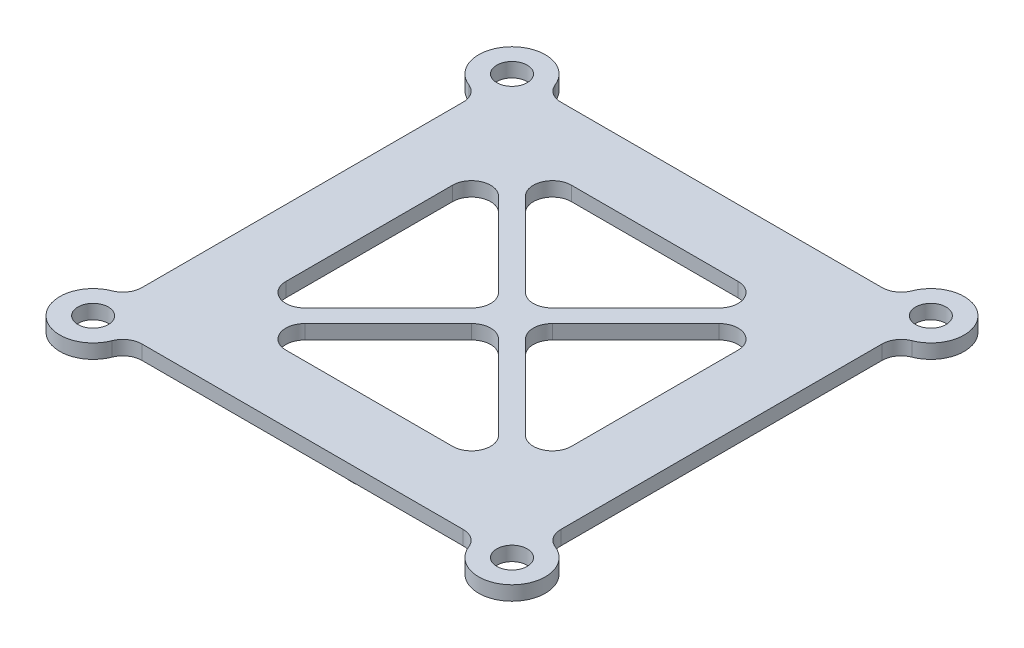
from build123d import *

# Parameters (mm, degrees)
BOSS_EXTRUDE1_DEPTH            = 0.75
FILLET1_R                      = 2
F_3_2_3_2_DIAMETER_HOLE1_D     = 3.2
F_3_2_3_2_DIAMETER_HOLE1_DEPTH = 10
F_3_2_3_2_DIAMETER_HOLE1_TIP   = 0.96137699
CUT_EXTRUDE1_DEPTH             = 1.5
FILLET2_R                      = 2
SKETCH5_W                      = 0.759829059
SKETCH5_H                      = 4.233333333
BOSS_EXTRUDE2_DEPTH            = 0.7
BOSS_EXTRUDE3_DEPTH            = 0.7


with BuildPart() as part:
    # Sketch1 → Boss-Extrude1 (new, symmetric)
    with BuildSketch(Plane(origin=(0, 0, 0), x_dir=(1, 0, 0), z_dir=(0, 1, 0))):
        with BuildLine():
            Line((-18.5, -22), (18.5, -22))
            ThreePointArc((18.5, -22), (24.474873734, -24.474873734), (22, -18.5))
            Line((22, -18.5), (22, 18.5))
            ThreePointArc((22, 18.5), (24.474873734, 24.474873734), (18.5, 22))
            Line((18.5, 22), (-18.5, 22))
            ThreePointArc((-18.5, 22), (-24.474873734, 24.474873734), (-22, 18.5))
            Line((-22, 18.5), (-22, -18.5))
            ThreePointArc((-22, -18.5), (-24.474873734, -24.474873734), (-18.5, -22))
        make_face()
    extrude(amount=BOSS_EXTRUDE1_DEPTH, both=True)

    # Fillet1
    fillet1_edges = [part.edges().sort_by_distance(p)[0] for p in [
        (-18.5, 0, -22),
        (18.5, 0, -22),
        (22, 0, -18.5),
        (22, 0, 18.5),
        (18.5, 0, 22),
        (-18.5, 0, 22),
        (-22, 0, 18.5),
        (-22, 0, -18.5),
    ]]
    fillet(fillet1_edges, radius=FILLET1_R)

    # Ø3.2 (3.2) Diameter Hole1
    with Locations(Plane(origin=(0, 0.75, 0), x_dir=(1, 0, 0), z_dir=(0, 1, 0))):
        with Locations((-22, 22), (-22, -22), (22, -22), (22, 22)):
            Hole(F_3_2_3_2_DIAMETER_HOLE1_D / 2, depth=F_3_2_3_2_DIAMETER_HOLE1_DEPTH)
            with Locations((0, 0, -(F_3_2_3_2_DIAMETER_HOLE1_DEPTH + F_3_2_3_2_DIAMETER_HOLE1_TIP / 2))):  # 118° drill point
                Cone(0, F_3_2_3_2_DIAMETER_HOLE1_D / 2, F_3_2_3_2_DIAMETER_HOLE1_TIP, mode=Mode.SUBTRACT)

    # Sketch4 → Cut-Extrude1 (cut)
    with BuildSketch(Plane(origin=(0, 0.75, 0), x_dir=(1, 0, 0), z_dir=(0, 1, 0))):
        Polygon((-1.414213562, 0), (-15, 13.585786438), (-15, -13.585786438), align=None)
        Polygon((13.585786438, 15), (-13.585786438, 15), (0, 1.414213562), align=None)
        Polygon((15, -13.585786438), (15, 13.585786438), (1.414213562, 0), align=None)
        Polygon((0, -1.414213562), (-13.585786438, -15), (13.585786438, -15), align=None)
    extrude(amount=-CUT_EXTRUDE1_DEPTH, mode=Mode.SUBTRACT)

    # Fillet2
    fillet2_edges = [part.edges().sort_by_distance(p)[0] for p in [
        (-1.414213562, 0, 0),
        (-15, 0, 13.585786438),
        (-15, 0, -13.585786438),
        (13.585786438, 0, -15),
        (0, 0, -1.414213562),
        (-13.585786438, 0, -15),
        (15, 0, -13.585786438),
        (15, 0, 13.585786438),
        (1.414213562, 0, 0),
        (0, 0, 1.414213562),
        (13.585786438, 0, 15),
        (-13.585786438, 0, 15),
    ]]
    fillet(fillet2_edges, radius=FILLET2_R)

    # Sketch5 → Boss-Extrude2 (add)
    # profile 1 of 8: a face of its own
    with BuildSketch(Plane.XZ.offset(0.75)):
        Polygon((-12.790030195, -16.641256876), (-12.083626616, -16.641256876), (-10.374011231, -20.874590209), (-11.185569725, -20.874590209), (-11.514602844, -20.006214141), (-13.357357919, -20.006214141), (-13.687239062, -20.874590209), (-14.498797556, -20.874590209), align=None)
        Polygon((-12.436404394, -17.776760348), (-13.069029928, -19.246385081), (-11.802930836, -19.246385081), align=None, mode=Mode.SUBTRACT)
    # profile 2 of 8: a face of its own
    with BuildSketch(Plane.XZ.offset(0.75)):
        Polygon((-9.749865932, -16.641256876), (-8.990036872, -16.641256876), (-8.990036872, -18.131234173), (-7.78923559, -16.641256876), (-6.830121007, -16.641256876), (-8.338754821, -18.513692774), (-6.683412941, -20.874590209), (-7.598430302, -20.874590209), (-8.990036872, -18.889367186), (-8.990036872, -20.874590209), (-9.749865932, -20.874590209), align=None)
    # profile 3 of 8: a face of its own
    with BuildSketch(Plane.XZ.offset(0.75)):
        Polygon((-4.811825067, -16.641256876), (-4.105421488, -16.641256876), (-2.395806103, -20.874590209), (-3.207364597, -20.874590209), (-3.536397716, -20.006214141), (-5.379152791, -20.006214141), (-5.709033934, -20.874590209), (-6.520592428, -20.874590209), align=None)
        Polygon((-4.458199265, -17.776760348), (-5.0908248, -19.246385081), (-3.824725708, -19.246385081), align=None, mode=Mode.SUBTRACT)
    # profile 4 of 8: a face of its own
    with BuildSketch(Plane.XZ.offset(0.75)):
        with BuildLine():
            Line((0.399279367, -17.206888553), (-0.168896381, -17.726726962))
            add(Edge.make_bspline(
                [(-0.168896381, -17.726726962), (-0.193234594, -17.692395382), (-0.239960568, -17.626483538), (-0.315698499, -17.538226024), (-0.391094434, -17.462935797), (-0.466846871, -17.400927385), (-0.543627251, -17.352577533), (-0.621302294, -17.318345304), (-0.699431639, -17.296583552), (-0.751922498, -17.29387369), (-0.777777257, -17.292538927)],
                knots=[0, 0, 0, 0, 1.299362458, 2.494594718, 3.587462134, 4.587049575, 5.512617175, 6.380583204, 7.202344345, 8, 8, 8, 8], degree=3))
            add(Edge.make_bspline(
                [(-0.777777257, -17.292538927), (-0.801893834, -17.293384694), (-0.848456609, -17.295017647), (-0.914835299, -17.311249081), (-0.973767245, -17.339262151), (-1.025194933, -17.375891597), (-1.065933249, -17.420021587), (-1.098459635, -17.4663026), (-1.116774724, -17.517386371), (-1.11918535, -17.552472766), (-1.120378753, -17.569842613)],
                knots=[0, 0, 0, 0, 1.185010067, 2.2879431, 3.333075148, 4.379039566, 5.372662701, 6.27520591, 7.14612461, 8, 8, 8, 8], degree=3))
            add(Edge.make_bspline(
                [(-1.120378753, -17.569842613), (-1.119630907, -17.587462941), (-1.118124851, -17.622947833), (-1.1035784, -17.67495536), (-1.081652744, -17.725772769), (-1.060701884, -17.756707744), (-1.049992802, -17.772520231)],
                knots=[0, 0, 0, 0, 0.967525499, 1.948461899, 2.951351359, 4, 4, 4, 4], degree=3))
            add(Edge.make_bspline(
                [(-1.049992802, -17.772520231), (-1.040257087, -17.784811111), (-1.017846759, -17.813103095), (-0.975114852, -17.857913188), (-0.921452552, -17.912809473), (-0.85479482, -17.975904229), (-0.777908801, -18.04946659), (-0.68723073, -18.130604792), (-0.585370717, -18.221831589), (-0.51297098, -18.285358628), (-0.475032866, -18.318647368)],
                knots=[0, 0, 0, 0, 0.473873513, 1.090794244, 1.870441696, 2.795289791, 3.865433203, 5.087734844, 6.473946851, 8, 8, 8, 8], degree=3))
            add(Edge.make_bspline(
                [(-0.475032866, -18.318647368), (-0.439422489, -18.349466353), (-0.371841391, -18.407954384), (-0.275686909, -18.490968754), (-0.191183134, -18.565654758), (-0.117099039, -18.630891519), (-0.054557665, -18.687363521), (-0.00329609, -18.735340699), (0.037311761, -18.773889026), (0.060394946, -18.797172238), (0.070246247, -18.807108906)],
                knots=[0, 0, 0, 0, 1.543621617, 2.929473131, 4.163658386, 5.240097082, 6.164993805, 6.925417477, 7.541396219, 8, 8, 8, 8], degree=3))
            add(Edge.make_bspline(
                [(0.070246247, -18.807108906), (0.107620031, -18.847555344), (0.179465567, -18.925307601), (0.272839437, -19.045799147), (0.349689152, -19.163423465), (0.409141549, -19.280393847), (0.454042391, -19.398397942), (0.485698079, -19.520329796), (0.504656881, -19.647463518), (0.50676175, -19.734216764), (0.507826376, -19.778095818)],
                knots=[0, 0, 0, 0, 1.206664779, 2.319633467, 3.337109185, 4.282041471, 5.190008762, 6.099243693, 7.03861361, 8, 8, 8, 8], degree=3))
            add(Edge.make_bspline(
                [(0.507826376, -19.778095818), (0.507068603, -19.820850576), (0.505581824, -19.904737001), (0.487371635, -20.027492289), (0.461404975, -20.144974427), (0.421255964, -20.255905044), (0.372322586, -20.362105031), (0.31097753, -20.461920131), (0.238936173, -20.556360514), (0.156365716, -20.643737941), (0.065032987, -20.7230269), (-0.032930046, -20.793611804), (-0.138481314, -20.851888633), (-0.250719002, -20.899875445), (-0.369583035, -20.936835529), (-0.494931807, -20.964152476), (-0.626957049, -20.980547677), (-0.717237812, -20.982261601), (-0.763360857, -20.983137218)],
                knots=[0, 0, 0, 0, 1.043214005, 2.046824704, 3.02475056, 3.976699089, 4.921714032, 5.875962561, 6.831408892, 7.817874052, 8.806269674, 9.781291748, 10.760897367, 11.74438705, 12.757449933, 13.795994037, 14.874007457, 16, 16, 16, 16], degree=3))
            add(Edge.make_bspline(
                [(-0.763360857, -20.983137218), (-0.799567055, -20.982494896), (-0.87127609, -20.98122273), (-0.976964367, -20.970836553), (-1.079018346, -20.954074368), (-1.177323072, -20.930049151), (-1.272321425, -20.899605941), (-1.364017307, -20.862420727), (-1.451777711, -20.817917151), (-1.536266673, -20.767010385), (-1.617073473, -20.707900923), (-1.69521988, -20.641797239), (-1.769929672, -20.56768263), (-1.841561664, -20.485732374), (-1.909657533, -20.395714406), (-1.976446303, -20.298882394), (-2.03895968, -20.193439268), (-2.077576973, -20.119470062), (-2.09730183, -20.081688233)],
                knots=[0, 0, 0, 0, 1.016823716, 2.013894106, 2.979844003, 3.91962641, 4.853723003, 5.779685073, 6.695824784, 7.614987388, 8.547259901, 9.504950863, 10.487499108, 11.500346958, 12.559593716, 13.656357062, 14.802919212, 16, 16, 16, 16], degree=3))
            Line((-2.09730183, -20.081688233), (-1.429059308, -19.680573115))
            add(Edge.make_bspline(
                [(-1.429059308, -19.680573115), (-1.404386461, -19.723460427), (-1.357086504, -19.80567907), (-1.276932306, -19.916150236), (-1.194818421, -20.010750504), (-1.108846452, -20.087807807), (-1.020061784, -20.148352501), (-0.928035567, -20.19162194), (-0.832703145, -20.218405674), (-0.76776703, -20.221676586), (-0.735376082, -20.223308158)],
                knots=[0, 0, 0, 0, 1.283663364, 2.460892379, 3.537111102, 4.529833553, 5.449777664, 6.316464042, 7.160231139, 8, 8, 8, 8], degree=3))
            add(Edge.make_bspline(
                [(-0.735376082, -20.223308158), (-0.702429849, -20.221975728), (-0.63850936, -20.219390619), (-0.547271042, -20.195512748), (-0.463620297, -20.158022738), (-0.391313211, -20.104529664), (-0.330088129, -20.042790526), (-0.284900505, -19.974102913), (-0.256513334, -19.899784573), (-0.253512122, -19.848158165), (-0.252002684, -19.822193041)],
                knots=[0, 0, 0, 0, 1.13588714, 2.203786484, 3.234766741, 4.283437687, 5.291419208, 6.222934724, 7.106237994, 8, 8, 8, 8], degree=3))
            add(Edge.make_bspline(
                [(-0.252002684, -19.822193041), (-0.253396588, -19.798036717), (-0.256228171, -19.748965459), (-0.277084735, -19.676004389), (-0.309689906, -19.603076501), (-0.348264122, -19.543259073), (-0.387518217, -19.493175563), (-0.425053986, -19.449780466), (-0.470762624, -19.401836482), (-0.524528232, -19.3492833), (-0.585640428, -19.291658281), (-0.65415069, -19.228967068), (-0.730843534, -19.161761895), (-0.785050187, -19.115982396), (-0.813394244, -19.092044803)],
                knots=[0, 0, 0, 0, 0.916159276, 1.861089862, 2.860218735, 3.940849679, 4.552606315, 5.27541173, 6.11797699, 7.06649574, 8.129236253, 9.306560635, 10.591630461, 12, 12, 12, 12], degree=3))
            add(Edge.make_bspline(
                [(-0.813394244, -19.092044803), (-0.867277425, -19.046454466), (-0.970695558, -18.958952808), (-1.1168385, -18.829715615), (-1.248526377, -18.708931615), (-1.36462179, -18.595107656), (-1.466603975, -18.490345802), (-1.553782263, -18.393795136), (-1.625198962, -18.304710903), (-1.700349638, -18.19919659), (-1.771757805, -18.070620151), (-1.833474726, -17.915927788), (-1.873514059, -17.761255053), (-1.87799991, -17.657416299), (-1.880207812, -17.606307624)],
                knots=[0, 0, 0, 0, 1.345494975, 2.582412109, 3.71882943, 4.751509156, 5.681369928, 6.505683931, 7.230279997, 7.856715994, 8.973648664, 10.023341002, 11.027102913, 12, 12, 12, 12], degree=3))
            add(Edge.make_bspline(
                [(-1.880207812, -17.606307624), (-1.879289549, -17.570064095), (-1.87748047, -17.49866045), (-1.861343212, -17.393671793), (-1.837225466, -17.292366561), (-1.802199574, -17.195114361), (-1.756740195, -17.102037005), (-1.701531545, -17.012678841), (-1.635716339, -16.927862301), (-1.561547045, -16.847643612), (-1.479831472, -16.77433286), (-1.392507998, -16.709628775), (-1.300070881, -16.654978764), (-1.203085605, -16.609642611), (-1.100951192, -16.574940667), (-0.994420062, -16.550342199), (-0.883339416, -16.535711814), (-0.807784758, -16.533722983), (-0.769297022, -16.532709868)],
                knots=[0, 0, 0, 0, 1.010766082, 1.991317756, 2.957454644, 3.913069143, 4.869106762, 5.843196583, 6.838735724, 7.860187025, 8.887984031, 9.89767229, 10.887916223, 11.879572884, 12.879850636, 13.892031539, 14.926195476, 16, 16, 16, 16], degree=3))
            add(Edge.make_bspline(
                [(-0.769297022, -16.532709868), (-0.719418821, -16.534534518), (-0.62005614, -16.538169417), (-0.473145551, -16.566593136), (-0.32964943, -16.611292428), (-0.214017566, -16.665217206), (-0.12201145, -16.717454164), (-0.051497357, -16.765547375), (0.020254528, -16.820640733), (0.09382284, -16.882907851), (0.167840565, -16.953521925), (0.244412382, -17.03080193), (0.322494905, -17.115415746), (0.373236165, -17.175863464), (0.399279367, -17.206888553)],
                knots=[0, 0, 0, 0, 1.282922637, 2.555718331, 3.837320111, 5.142675274, 5.830281639, 6.55870424, 7.337177975, 8.157850921, 9.037902056, 9.96903443, 10.957596896, 12, 12, 12, 12], degree=3))
        make_face()
    # profile 5 of 8: a face of its own
    with BuildSketch(Plane.XZ.offset(0.75)):
        Polygon((1.267655435, -16.641256876), (2.027484495, -16.641256876), (2.027484495, -18.269462004), (3.492869111, -18.269462004), (3.492869111, -16.641256876), (4.25269817, -16.641256876), (4.25269817, -20.874590209), (3.492869111, -20.874590209), (3.492869111, -19.029291064), (2.027484495, -19.029291064), (2.027484495, -20.874590209), (1.267655435, -20.874590209), align=None)
    # profile 6 of 8: a face of its own
    with BuildSketch(Plane.XZ.offset(0.75)):
        with BuildLine():
            Line((5.229621247, -16.641256876), (6.187039784, -16.641256876))
            add(Edge.make_bspline(
                [(6.187039784, -16.641256876), (6.261681571, -16.641778648), (6.405964989, -16.642787238), (6.615003119, -16.654151627), (6.809381978, -16.671629251), (6.989226869, -16.69567289), (7.154169079, -16.727489208), (7.303995919, -16.767396544), (7.439210245, -16.813462923), (7.561294652, -16.867669367), (7.672745973, -16.930868697), (7.778572559, -17.001267676), (7.878566623, -17.081445226), (7.974131423, -17.169854561), (8.064033674, -17.268113103), (8.149770572, -17.374593334), (8.229242887, -17.490839366), (8.304852897, -17.614063983), (8.37323209, -17.744789402), (8.432874977, -17.881902914), (8.482838186, -18.024522142), (8.52343588, -18.172799082), (8.555796927, -18.326241499), (8.5784393, -18.485159026), (8.59243704, -18.649404532), (8.593856994, -18.760721776), (8.594578512, -18.817285188)],
                knots=[0, 0, 0, 0, 1.44355588, 2.790409838, 4.047694926, 5.217575253, 6.298404546, 7.294384826, 8.214239204, 9.058592145, 9.873746385, 10.689560431, 11.514393297, 12.350027578, 13.205127629, 14.088021785, 14.991911688, 15.926770944, 16.882954281, 17.842803888, 18.816321264, 19.80318086, 20.814351908, 21.847355356, 22.906180909, 24, 24, 24, 24], degree=3))
            add(Edge.make_bspline(
                [(8.594578512, -18.817285188), (8.592689188, -18.897099845), (8.588969942, -19.054219668), (8.557641094, -19.284791198), (8.506971739, -19.505817007), (8.435726023, -19.715568144), (8.347400408, -19.912176746), (8.24188557, -20.092175701), (8.120728602, -20.254598867), (7.98534099, -20.398637509), (7.838749181, -20.522440674), (7.68641073, -20.628469024), (7.526841584, -20.712081226), (7.386238866, -20.765103866), (7.264318768, -20.79807936), (7.157274242, -20.817568195), (7.035682582, -20.835440632), (6.898410051, -20.849252067), (6.746058836, -20.861568472), (6.578021661, -20.868260728), (6.394842583, -20.873820999), (6.267607394, -20.874327087), (6.201456183, -20.874590209)],
                knots=[0, 0, 0, 0, 1.315458931, 2.589557908, 3.828601765, 5.048913369, 6.235739168, 7.376350998, 8.481830359, 9.569842114, 10.627874879, 11.640079404, 12.624025415, 13.590060155, 14.111227486, 14.704434459, 15.382649715, 16.137166398, 16.978595427, 17.902333227, 18.909396075, 20, 20, 20, 20], degree=3))
            Line((6.201456183, -20.874590209), (5.229621247, -20.874590209))
            Line((5.229621247, -20.874590209), (5.229621247, -16.641256876))
        make_face()
        with BuildLine():
            Line((5.989450307, -17.401085936), (5.989450307, -20.11476115))
            Line((5.989450307, -20.11476115), (6.386325307, -20.11476115))
            add(Edge.make_bspline(
                [(6.386325307, -20.11476115), (6.433547337, -20.114674619), (6.524371021, -20.114508193), (6.655499862, -20.106581151), (6.77676079, -20.098624586), (6.887820005, -20.083522761), (6.989485758, -20.06670039), (7.080361431, -20.043289758), (7.162320364, -20.018698872), (7.234361446, -19.987391627), (7.300345206, -19.952153238), (7.361438632, -19.910867381), (7.420410893, -19.865020993), (7.476159455, -19.813265668), (7.528895312, -19.756286742), (7.578306447, -19.69379063), (7.625052366, -19.625968008), (7.667933192, -19.552460282), (7.707117919, -19.474043709), (7.741879164, -19.391477869), (7.770701365, -19.304075165), (7.794656614, -19.212653793), (7.811775356, -19.116417825), (7.825937849, -19.016080068), (7.833239027, -18.911242992), (7.834241068, -18.839908342), (7.834749453, -18.803716812)],
                knots=[0, 0, 0, 0, 1.50275155, 2.890291501, 4.180787663, 5.369391935, 6.45668281, 7.458360028, 8.354766181, 9.177074746, 9.954075863, 10.732690366, 11.5210699, 12.329727389, 13.151100085, 13.990027547, 14.863562427, 15.770965086, 16.696477834, 17.652329173, 18.619756807, 19.62365428, 20.657822005, 21.729286259, 22.847956731, 24, 24, 24, 24], degree=3))
            add(Edge.make_bspline(
                [(7.834749453, -18.803716812), (7.833736924, -18.748256714), (7.831762572, -18.640113821), (7.812722346, -18.482601336), (7.78172849, -18.334279735), (7.737503244, -18.195699479), (7.681755951, -18.066471085), (7.611975218, -17.947689392), (7.531164141, -17.837359029), (7.467260945, -17.772635698), (7.435330382, -17.740295338)],
                knots=[0, 0, 0, 0, 1.13821349, 2.219428113, 3.251817212, 4.244760574, 5.201143372, 6.134805572, 7.068016741, 8, 8, 8, 8], degree=3))
            add(Edge.make_bspline(
                [(7.435330382, -17.740295338), (7.403843823, -17.712736978), (7.339536093, -17.65645215), (7.22663285, -17.589008531), (7.102219324, -17.529752702), (6.963449306, -17.482769437), (6.811663947, -17.445613069), (6.64595921, -17.41998723), (6.46722248, -17.403520338), (6.343397838, -17.401914788), (6.279474346, -17.401085936)],
                knots=[0, 0, 0, 0, 0.813307809, 1.661089106, 2.549956539, 3.493439533, 4.508053171, 5.589449661, 6.755572447, 8, 8, 8, 8], degree=3))
            Line((6.279474346, -17.401085936), (5.989450307, -17.401085936))
        make_face(mode=Mode.SUBTRACT)
    # profile 7 of 8: a face of its own
    with BuildSketch(Plane.XZ.offset(0.75)):
        with Locations((9.625775093, -18.757923543)):
            Rectangle(SKETCH5_W, SKETCH5_H)
    # profile 8 of 8: a face of its own
    with BuildSketch(Plane.XZ.offset(0.75)):
        with BuildLine():
            Line((10.9826127, -16.641256876), (11.830636205, -16.641256876))
            add(Edge.make_bspline(
                [(11.830636205, -16.641256876), (11.88604496, -16.641504898), (11.992940064, -16.641983383), (12.147091599, -16.647785653), (12.289303937, -16.658183674), (12.419544406, -16.671033984), (12.537759455, -16.689049618), (12.644097122, -16.709703133), (12.738579478, -16.734865124), (12.822271949, -16.764732059), (12.897383239, -16.799944009), (12.968462745, -16.837447249), (13.033904062, -16.882206043), (13.097010211, -16.929396478), (13.154173305, -16.98352664), (13.20895952, -17.040994086), (13.259048511, -17.104077928), (13.30467237, -17.172014554), (13.346060241, -17.243548786), (13.382219453, -17.318808504), (13.411549782, -17.397912801), (13.43615428, -17.48034996), (13.455916853, -17.56611639), (13.46907145, -17.655739561), (13.478006715, -17.74859369), (13.478795128, -17.811790269), (13.479193897, -17.843754205)],
                knots=[0, 0, 0, 0, 1.698747864, 3.27724071, 4.728299578, 6.070144658, 7.288476769, 8.393259625, 9.389771311, 10.283485332, 11.113357557, 11.931608583, 12.74405601, 13.541433047, 14.344816069, 15.154114104, 15.974336324, 16.810834471, 17.661136416, 18.50621059, 19.367396281, 20.244825668, 21.142564693, 22.063065223, 23.020325768, 24, 24, 24, 24], degree=3))
            add(Edge.make_bspline(
                [(13.479193897, -17.843754205), (13.478616929, -17.879115147), (13.477483116, -17.948603743), (13.466368092, -18.050465499), (13.44738012, -18.147581461), (13.422563834, -18.240770626), (13.387959289, -18.328499824), (13.34842522, -18.412862302), (13.299785775, -18.491492794), (13.244207434, -18.565374873), (13.183509546, -18.635109237), (13.116251143, -18.698682435), (13.043714202, -18.756527846), (12.966318612, -18.809251693), (12.883773806, -18.85674762), (12.796139346, -18.899460377), (12.702816813, -18.936023878), (12.637829809, -18.955146292), (12.604881664, -18.964841278)],
                knots=[0, 0, 0, 0, 1.102006807, 2.165578795, 3.188629044, 4.184801286, 5.166646146, 6.124351954, 7.085497154, 8.042432466, 9.003981491, 9.963833307, 10.922997304, 11.89326795, 12.880200226, 13.889073926, 14.929769137, 16, 16, 16, 16], degree=3))
            add(Edge.make_bspline(
                [(12.604881664, -18.964841278), (12.583180121, -18.970240657), (12.536167589, -18.981937451), (12.458374763, -18.993812632), (12.368726698, -19.004731132), (12.266933504, -19.01411426), (12.152936495, -19.020492601), (12.02684605, -19.025473802), (11.888605026, -19.029095649), (11.792477684, -19.029224168), (11.74244176, -19.029291064)],
                knots=[0, 0, 0, 0, 0.618981996, 1.340914327, 2.176866532, 3.120127938, 4.170906482, 5.338178032, 6.614476169, 8, 8, 8, 8], degree=3))
            Line((11.74244176, -19.029291064), (11.74244176, -20.874590209))
            Line((11.74244176, -20.874590209), (10.9826127, -20.874590209))
            Line((10.9826127, -20.874590209), (10.9826127, -16.641256876))
        make_face()
        with BuildLine():
            Line((11.74244176, -18.269462004), (12.011265211, -18.269462004))
            add(Edge.make_bspline(
                [(12.011265211, -18.269462004), (12.060181882, -18.269151835), (12.150189283, -18.268581118), (12.273107609, -18.260328221), (12.37188714, -18.247724382), (12.449924804, -18.22964756), (12.511542931, -18.20221359), (12.564684708, -18.170477653), (12.610265766, -18.130348432), (12.649732254, -18.084493931), (12.681284522, -18.03180481), (12.703164376, -17.973139011), (12.717377099, -17.909729164), (12.718689776, -17.865600107), (12.719364837, -17.842906182)],
                knots=[0, 0, 0, 0, 1.8619151, 3.425951444, 4.686033666, 5.651700536, 6.461346321, 7.243864085, 7.999046032, 8.762387399, 9.539336099, 10.322741239, 11.137448474, 12, 12, 12, 12], degree=3))
            add(Edge.make_bspline(
                [(12.719364837, -17.842906182), (12.71869672, -17.823078795), (12.717400413, -17.784608897), (12.707877387, -17.729087292), (12.692700423, -17.677329702), (12.670709585, -17.629876668), (12.642280639, -17.586808819), (12.607620001, -17.548143121), (12.567172434, -17.513051516), (12.535944548, -17.494476994), (12.520079314, -17.485040263)],
                knots=[0, 0, 0, 0, 1.102301479, 2.1387299, 3.123554645, 4.094223062, 5.036071848, 5.982632524, 6.975082478, 8, 8, 8, 8], degree=3))
            add(Edge.make_bspline(
                [(12.520079314, -17.485040263), (12.506640544, -17.478243892), (12.478187916, -17.463854582), (12.429730331, -17.447125957), (12.373811018, -17.433013519), (12.310052459, -17.421300331), (12.238709004, -17.412209682), (12.159793384, -17.405257609), (12.073189464, -17.402461909), (12.012961621, -17.401557244), (11.981584388, -17.401085936)],
                knots=[0, 0, 0, 0, 0.656809284, 1.390599849, 2.23162475, 3.173112763, 4.218524733, 5.370385145, 6.63003504, 8, 8, 8, 8], degree=3))
            Line((11.981584388, -17.401085936), (11.74244176, -17.401085936))
            Line((11.74244176, -17.401085936), (11.74244176, -18.269462004))
        make_face(mode=Mode.SUBTRACT)
    extrude(amount=BOSS_EXTRUDE2_DEPTH)

    # Sketch6 → Boss-Extrude3 (add)
    # profile 1 of 7: a face of its own
    with BuildSketch(Plane.XZ.offset(0.75)):
        with BuildLine():
            Line((-10.234058943, 15.95628585), (-12.161616368, 15.95628585))
            Line((-12.161616368, 15.95628585), (-12.161616368, 16.661841406))
            Line((-12.161616368, 16.661841406), (-10.836155631, 16.661841406))
            Line((-10.836155631, 16.661841406), (-10.670791048, 17.462375594))
            add(Edge.make_bspline(
                [(-10.670791048, 17.462375594), (-10.693321103, 17.456081142), (-10.738022676, 17.443592407), (-10.805024086, 17.431484066), (-10.869871259, 17.4232056), (-10.912170972, 17.422174204), (-10.932830311, 17.421670465)],
                knots=[0, 0, 0, 0, 1.054652254, 2.092520994, 3.068380062, 4, 4, 4, 4], degree=3))
            add(Edge.make_bspline(
                [(-10.932830311, 17.421670465), (-10.977844357, 17.422701936), (-11.06657696, 17.424735192), (-11.196381497, 17.444037425), (-11.32067701, 17.474437857), (-11.43908314, 17.517795146), (-11.55148422, 17.574225776), (-11.658016503, 17.642491021), (-11.758810739, 17.722710778), (-11.852076398, 17.814935271), (-11.937772781, 17.916199853), (-12.012280899, 18.025728213), (-12.075915481, 18.141958584), (-12.126528228, 18.265613451), (-12.166476123, 18.395916178), (-12.195343363, 18.532950267), (-12.212414005, 18.676878124), (-12.214715876, 18.775069811), (-12.215889873, 18.825149365)],
                knots=[0, 0, 0, 0, 1.01440847, 1.999622559, 2.951875003, 3.895578053, 4.836219714, 5.782137149, 6.743708247, 7.735272588, 8.734977101, 9.730283169, 10.717124674, 11.717316708, 12.737475749, 13.78628267, 14.87096371, 16, 16, 16, 16], degree=3))
            add(Edge.make_bspline(
                [(-12.215889873, 18.825149365), (-12.214462589, 18.875799949), (-12.211646142, 18.975748356), (-12.193071002, 19.122664544), (-12.160837815, 19.263631809), (-12.114728219, 19.397796715), (-12.056541558, 19.526141857), (-11.986317023, 19.648823394), (-11.901426754, 19.764474961), (-11.805345912, 19.873040403), (-11.700512449, 19.972352864), (-11.58860339, 20.059487103), (-11.471510432, 20.134107368), (-11.347573403, 20.193290056), (-11.218688638, 20.240350052), (-11.084408506, 20.274535015), (-10.944153845, 20.294154823), (-10.848936431, 20.296814376), (-10.800538644, 20.298166192)],
                knots=[0, 0, 0, 0, 1.068252361, 2.107974174, 3.117445057, 4.112928197, 5.094821713, 6.085741881, 7.08864209, 8.115013732, 9.139860459, 10.12970393, 11.102304324, 12.062250553, 13.020362151, 13.992066755, 14.979393365, 16, 16, 16, 16], degree=3))
            add(Edge.make_bspline(
                [(-10.800538644, 20.298166192), (-10.757266547, 20.297023833), (-10.671924917, 20.294770862), (-10.546020203, 20.281874904), (-10.425267945, 20.256263657), (-10.308477589, 20.224109478), (-10.197263849, 20.17978676), (-10.089334999, 20.128852647), (-9.98794007, 20.064905837), (-9.89019848, 19.994459115), (-9.799867734, 19.914453434), (-9.715998266, 19.827999653), (-9.641780406, 19.733481713), (-9.574449061, 19.632736683), (-9.517662547, 19.523883444), (-9.466898695, 19.40888004), (-9.425427595, 19.286431965), (-9.404369288, 19.201555857), (-9.39366765, 19.158422602)],
                knots=[0, 0, 0, 0, 1.055144606, 2.080965977, 3.079696235, 4.061281178, 5.030010203, 5.994686618, 6.966205752, 7.947572972, 8.929036963, 9.903776773, 10.879904045, 11.854643856, 12.853445432, 13.868704235, 14.916895142, 16, 16, 16, 16], degree=3))
            Line((-9.39366765, 19.158422602), (-10.262043719, 19.158422602))
            add(Edge.make_bspline(
                [(-10.262043719, 19.158422602), (-10.277909961, 19.18832364), (-10.308744192, 19.246432896), (-10.367532215, 19.3234055), (-10.432882252, 19.389746925), (-10.506531291, 19.442976135), (-10.584567773, 19.485640296), (-10.667161783, 19.516944492), (-10.75424764, 19.534929453), (-10.813743933, 19.537193735), (-10.843787843, 19.538337132)],
                knots=[0, 0, 0, 0, 1.105237818, 2.14790357, 3.154462025, 4.139874369, 5.10774607, 6.055457142, 7.018062016, 8, 8, 8, 8], degree=3))
            add(Edge.make_bspline(
                [(-10.843787843, 19.538337132), (-10.864727331, 19.537549033), (-10.905926126, 19.535998434), (-10.966628878, 19.527801618), (-11.024561342, 19.512256865), (-11.080206433, 19.490798842), (-11.133729289, 19.463682982), (-11.184860302, 19.430366489), (-11.233343209, 19.391058964), (-11.279016444, 19.346396974), (-11.32024097, 19.296479453), (-11.356706426, 19.243192431), (-11.3879004, 19.186582331), (-11.412147425, 19.126025028), (-11.431714051, 19.062193694), (-11.446208714, 18.995007975), (-11.454850466, 18.924313445), (-11.45565196, 18.876055221), (-11.456060813, 18.851438094)],
                knots=[0, 0, 0, 0, 0.978584799, 1.925382083, 2.854237347, 3.773848163, 4.706917643, 5.651871472, 6.619075428, 7.618203006, 8.630937754, 9.638147826, 10.630884984, 11.643619732, 12.679505692, 13.746568031, 14.850495961, 16, 16, 16, 16], degree=3))
            add(Edge.make_bspline(
                [(-11.456060813, 18.851438094), (-11.45571772, 18.827374029), (-11.455049406, 18.780499381), (-11.445595464, 18.712045662), (-11.433748938, 18.646514224), (-11.414598587, 18.584518315), (-11.391233868, 18.52536514), (-11.360688336, 18.470427435), (-11.32753252, 18.417183452), (-11.287147521, 18.369510975), (-11.244482966, 18.325365478), (-11.198443638, 18.286968767), (-11.150049242, 18.254645522), (-11.099350426, 18.228240533), (-11.046821848, 18.206361838), (-10.991275749, 18.192764454), (-10.934064139, 18.1823858), (-10.895002399, 18.181798028), (-10.875164712, 18.181499525)],
                knots=[0, 0, 0, 0, 1.166510573, 2.272258428, 3.34817395, 4.393855846, 5.415148486, 6.427654656, 7.43960333, 8.452852352, 9.451798603, 10.415864797, 11.355425197, 12.269514664, 13.186377996, 14.107845883, 15.039060727, 16, 16, 16, 16], degree=3))
            add(Edge.make_bspline(
                [(-10.875164712, 18.181499525), (-10.853612506, 18.182294796), (-10.810417261, 18.183888691), (-10.746462714, 18.197539361), (-10.682715385, 18.217743772), (-10.620004584, 18.247912415), (-10.557740538, 18.286620493), (-10.495816067, 18.333386606), (-10.434481666, 18.388958249), (-10.395727594, 18.430518547), (-10.375678868, 18.452019023)],
                knots=[0, 0, 0, 0, 0.882519632, 1.768758668, 2.670168731, 3.618680561, 4.612333577, 5.671392632, 6.795336641, 8, 8, 8, 8], degree=3))
            Line((-10.375678868, 18.452019023), (-9.736269146, 18.305310957))
            Line((-9.736269146, 18.305310957), (-10.234058943, 15.95628585))
        make_face()
    # profile 2 of 7: a face of its own
    with BuildSketch(Plane.XZ.offset(0.75)):
        with BuildLine():
            Line((-7.005633462, 17.367396961), (-6.245804403, 17.367396961))
            add(Edge.make_bspline(
                [(-6.245804403, 17.367396961), (-6.249084699, 17.309919311), (-6.255494202, 17.197611434), (-6.281017549, 17.034490733), (-6.31513008, 16.880321895), (-6.361046389, 16.73556841), (-6.417602625, 16.600169466), (-6.486206405, 16.474573562), (-6.564809467, 16.357880745), (-6.654996203, 16.252137575), (-6.75310637, 16.157071249), (-6.858888446, 16.073961771), (-6.972041943, 16.00438827), (-7.09181023, 15.947316809), (-7.217722871, 15.90165229), (-7.351052034, 15.871137936), (-7.490621265, 15.850468846), (-7.586168553, 15.84866051), (-7.634866903, 15.847738841)],
                knots=[0, 0, 0, 0, 1.198928049, 2.342633425, 3.435730849, 4.486331048, 5.502589352, 6.488331875, 7.46361919, 8.428949135, 9.378681775, 10.305958057, 11.226249248, 12.140413166, 13.066341608, 14.010670971, 14.986082777, 16, 16, 16, 16], degree=3))
            add(Edge.make_bspline(
                [(-7.634866903, 15.847738841), (-7.694668962, 15.849481699), (-7.811467894, 15.852885662), (-7.980644014, 15.885659541), (-8.13964912, 15.93614417), (-8.28691193, 16.008755474), (-8.421660613, 16.100736593), (-8.542293296, 16.21158567), (-8.649363623, 16.339942993), (-8.739341855, 16.484870393), (-8.812526759, 16.638868667), (-8.865367926, 16.797177884), (-8.899689126, 16.956606095), (-8.90337502, 17.063918821), (-8.905206112, 17.117230027)],
                knots=[0, 0, 0, 0, 1.075206757, 2.099977874, 3.089436832, 4.070080219, 5.043757236, 6.01602434, 7.009399377, 8.042659726, 9.078134622, 10.07077983, 11.041594984, 12, 12, 12, 12], degree=3))
            add(Edge.make_bspline(
                [(-8.905206112, 17.117230027), (-8.904495882, 17.149478281), (-8.903066364, 17.21438605), (-8.893126738, 17.312607434), (-8.878215337, 17.412657399), (-8.855732571, 17.514450155), (-8.827694745, 17.618014259), (-8.793680702, 17.723659553), (-8.752901968, 17.830787418), (-8.70603704, 17.940602176), (-8.650133817, 18.053465903), (-8.585014503, 18.171047571), (-8.508882252, 18.293670727), (-8.422480339, 18.420953601), (-8.3264174, 18.553883301), (-8.219231252, 18.690885482), (-8.102294693, 18.833506885), (-8.019274186, 18.928822747), (-7.976620375, 18.977793596)],
                knots=[0, 0, 0, 0, 0.728286467, 1.465860763, 2.227952348, 3.011875114, 3.818782069, 4.650637576, 5.517456182, 6.406927181, 7.346324104, 8.360844784, 9.441645378, 10.605053135, 11.834886952, 13.145197974, 14.533275831, 16, 16, 16, 16], degree=3))
            Line((-7.976620375, 18.977793596), (-7.534800129, 19.484063628))
            Line((-7.534800129, 19.484063628), (-8.959479616, 19.484063628))
            Line((-8.959479616, 19.484063628), (-8.959479616, 20.189619183))
            Line((-8.959479616, 20.189619183), (-6.137257394, 20.189619183))
            Line((-6.137257394, 20.189619183), (-6.137257394, 19.804616512))
            Line((-6.137257394, 19.804616512), (-7.390636133, 18.47067554))
            add(Edge.make_bspline(
                [(-7.390636133, 18.47067554), (-7.426925243, 18.431764455), (-7.497206488, 18.356405222), (-7.597200123, 18.245725849), (-7.687718831, 18.140716436), (-7.766738626, 18.040159223), (-7.839040432, 17.947458946), (-7.89952621, 17.85911118), (-7.952201913, 17.777603954), (-8.007227248, 17.678249887), (-8.060685818, 17.560647463), (-8.109706474, 17.425248383), (-8.139288424, 17.2957473), (-8.143403106, 17.211210534), (-8.145377052, 17.170655508)],
                knots=[0, 0, 0, 0, 1.246192343, 2.413505005, 3.49357156, 4.492416076, 5.408771964, 6.246246772, 6.999304986, 7.680960093, 8.904522682, 10.020616941, 11.0504258, 12, 12, 12, 12], degree=3))
            add(Edge.make_bspline(
                [(-8.145377052, 17.170655508), (-8.14392806, 17.131408574), (-8.141120406, 17.055361347), (-8.109497492, 16.947499291), (-8.062181798, 16.849100115), (-7.993488383, 16.764646175), (-7.910577186, 16.694641713), (-7.814220598, 16.643343289), (-7.706187801, 16.613192773), (-7.630535678, 16.609478597), (-7.591617704, 16.607567901)],
                knots=[0, 0, 0, 0, 1.061596218, 2.057012874, 3.024113775, 4.006148568, 4.986025304, 5.949989669, 6.945406325, 8, 8, 8, 8], degree=3))
            add(Edge.make_bspline(
                [(-7.591617704, 16.607567901), (-7.571516147, 16.608278883), (-7.531943006, 16.609678566), (-7.47377358, 16.618995872), (-7.418421193, 16.635416653), (-7.365269741, 16.657418187), (-7.31488647, 16.686581379), (-7.267398463, 16.72252966), (-7.222305374, 16.764349501), (-7.179814018, 16.811910138), (-7.141141336, 16.864987823), (-7.106792402, 16.9230978), (-7.078391552, 16.986203998), (-7.053386411, 17.053473319), (-7.03410125, 17.12562829), (-7.02005926, 17.202237072), (-7.009384073, 17.283175033), (-7.006906409, 17.33881227), (-7.005633462, 17.367396961)],
                knots=[0, 0, 0, 0, 0.903469896, 1.778625579, 2.63899355, 3.493148037, 4.358286772, 5.247621495, 6.164656832, 7.118446693, 8.109501108, 9.111810964, 10.146451449, 11.215617525, 12.33435995, 13.498009769, 14.714554818, 16, 16, 16, 16], degree=3))
        make_face()
    # profile 3 of 7: a face of its own
    with BuildSketch(Plane.XZ.offset(0.75)):
        with BuildLine():
            add(Edge.make_bspline(
                [(-4.360648153, 15.847738841), (-4.397427127, 15.848284653), (-4.469744418, 15.849357864), (-4.576252553, 15.860988066), (-4.678855565, 15.878544681), (-4.777925806, 15.90307743), (-4.872855683, 15.93537545), (-4.964056583, 15.974689247), (-5.051751495, 16.020289123), (-5.135147246, 16.074008879), (-5.21390515, 16.13513196), (-5.288567937, 16.203474042), (-5.357594364, 16.280144601), (-5.42343705, 16.363271998), (-5.48348412, 16.454687727), (-5.539447949, 16.552900101), (-5.590477551, 16.65895907), (-5.637284735, 16.772937283), (-5.679156148, 16.896572397), (-5.714325407, 17.031293445), (-5.744900357, 17.177004712), (-5.768979041, 17.334465051), (-5.788686858, 17.503303105), (-5.801563731, 17.68383479), (-5.81052177, 17.875554898), (-5.811244872, 18.007078041), (-5.811616368, 18.074648564)],
                knots=[0, 0, 0, 0, 0.879038005, 1.72842358, 2.558443055, 3.366573136, 4.165922485, 4.953092809, 5.739101687, 6.526504095, 7.321412341, 8.120218626, 8.943108119, 9.785446297, 10.653345205, 11.555363108, 12.486387694, 13.465363381, 14.499809521, 15.604758044, 16.79243262, 18.058048538, 19.411969755, 20.855614229, 22.384559651, 24, 24, 24, 24], degree=3))
            add(Edge.make_bspline(
                [(-5.811616368, 18.074648564), (-5.811212002, 18.143064032), (-5.810426324, 18.275994059), (-5.80196345, 18.469473739), (-5.787385373, 18.651295335), (-5.768610556, 18.821444823), (-5.742844435, 18.979816125), (-5.712884584, 19.12660672), (-5.676764193, 19.261854103), (-5.633740542, 19.38553637), (-5.586977868, 19.499894919), (-5.536258672, 19.605794521), (-5.481615806, 19.70406569), (-5.423641362, 19.794938489), (-5.360424154, 19.877286818), (-5.294577721, 19.952312849), (-5.224222604, 20.0189665), (-5.150494738, 20.07867667), (-5.071580928, 20.130940228), (-4.98783394, 20.175842428), (-4.898687164, 20.212949704), (-4.805437876, 20.244933935), (-4.706427075, 20.267945029), (-4.603183552, 20.286188542), (-4.494554229, 20.296274293), (-4.420594524, 20.297525209), (-4.382696764, 20.298166192)],
                knots=[0, 0, 0, 0, 1.643729521, 3.193736973, 4.651750042, 6.025799905, 7.305391353, 8.505533933, 9.624215592, 10.665924642, 11.64969722, 12.591402044, 13.485259159, 14.34997443, 15.17859563, 15.977254476, 16.745893235, 17.504291679, 18.254003551, 19.016677942, 19.783634514, 20.571857866, 21.382327253, 22.223106266, 23.08950026, 24, 24, 24, 24], degree=3))
            add(Edge.make_bspline(
                [(-4.382696764, 20.298166192), (-4.34480084, 20.297509957), (-4.270563283, 20.296224401), (-4.161628783, 20.286295556), (-4.057608449, 20.267708759), (-3.957663765, 20.245098382), (-3.862745324, 20.212711344), (-3.771772214, 20.175266168), (-3.686299333, 20.128899876), (-3.604749257, 20.077091531), (-3.528426849, 20.017372888), (-3.456196207, 19.950696508), (-3.387048198, 19.877993162), (-3.323445972, 19.796737621), (-3.264252211, 19.70841385), (-3.208838086, 19.613034259), (-3.158331566, 19.510286688), (-3.111034007, 19.40020036), (-3.069218891, 19.280127914), (-3.033036744, 19.148964495), (-3.002897282, 19.005583324), (-2.977094479, 18.850620013), (-2.959599822, 18.683181585), (-2.94468655, 18.504255106), (-2.936331792, 18.313305631), (-2.935532279, 18.182072357), (-2.935120642, 18.114505668)],
                knots=[0, 0, 0, 0, 0.917300563, 1.796978314, 2.644037383, 3.473869551, 4.274468802, 5.068727038, 5.852392514, 6.624895937, 7.405058545, 8.194438634, 9.002807344, 9.831001702, 10.688798588, 11.574866558, 12.499006576, 13.458565112, 14.473491784, 15.574131657, 16.749764288, 18.018652109, 19.374999853, 20.823441246, 22.364518758, 24, 24, 24, 24], degree=3))
            add(Edge.make_bspline(
                [(-2.935120642, 18.114505668), (-2.935857796, 18.020627417), (-2.937280146, 17.839488122), (-2.954843061, 17.577757593), (-2.981410972, 17.336012349), (-3.017780402, 17.113960292), (-3.066766061, 16.912036051), (-3.126882073, 16.730297625), (-3.195861167, 16.566946039), (-3.254546757, 16.470159899), (-3.282810279, 16.423546801)],
                knots=[0, 0, 0, 0, 1.288526675, 2.486228817, 3.599112392, 4.626206381, 5.5730174, 6.447949553, 7.252518174, 8, 8, 8, 8], degree=3))
            add(Edge.make_bspline(
                [(-3.282810279, 16.423546801), (-3.315680324, 16.377755377), (-3.37994774, 16.288224119), (-3.492321114, 16.170686314), (-3.613051673, 16.070162227), (-3.744619154, 15.988926809), (-3.884942763, 15.924864552), (-4.03522725, 15.879618101), (-4.194917638, 15.853255411), (-4.304579692, 15.849605158), (-4.360648153, 15.847738841)],
                knots=[0, 0, 0, 0, 1.058512271, 2.069600068, 3.047294572, 4.004278952, 4.967380941, 5.939006123, 6.946246673, 8, 8, 8, 8], degree=3))
        make_face()
        with BuildLine():
            add(Edge.make_bspline(
                [(-4.37930467, 16.607567901), (-4.346065795, 16.609160723), (-4.280899957, 16.612283498), (-4.186426632, 16.638199223), (-4.098122278, 16.679403472), (-4.029778298, 16.726754405), (-3.979429866, 16.773930851), (-3.942769026, 16.815269574), (-3.90994887, 16.863655684), (-3.878318537, 16.916972694), (-3.849888342, 16.976845579), (-3.822491838, 17.04166907), (-3.799080907, 17.113069879), (-3.776699959, 17.190436663), (-3.757384525, 17.275684592), (-3.740358368, 17.369610858), (-3.726367574, 17.472631583), (-3.714161409, 17.584860499), (-3.706511994, 17.706272537), (-3.699072024, 17.836837634), (-3.69636936, 17.976833716), (-3.695432954, 18.073235607), (-3.694949702, 18.122985903)],
                knots=[0, 0, 0, 0, 1.076633864, 2.110773886, 3.152647947, 4.225997476, 4.790367519, 5.388085217, 6.013768813, 6.68363944, 7.397140436, 8.161658524, 8.964785566, 9.832512219, 10.773307679, 11.798385074, 12.927758018, 14.144797317, 15.459104848, 16.872968649, 18.386227327, 20, 20, 20, 20], degree=3))
            add(Edge.make_bspline(
                [(-3.694949702, 18.122985903), (-3.695725648, 18.187441174), (-3.697213582, 18.311038933), (-3.704984604, 18.488775984), (-3.720654583, 18.650812673), (-3.739938917, 18.79767679), (-3.766954727, 18.928906785), (-3.800034303, 19.044469601), (-3.8368932, 19.145662033), (-3.883084494, 19.230749628), (-3.932578952, 19.30351625), (-3.985405426, 19.366463192), (-4.042486512, 19.418898717), (-4.102115727, 19.463415443), (-4.166504452, 19.496471714), (-4.234332356, 19.520570801), (-4.305750011, 19.535264584), (-4.354644716, 19.537307029), (-4.37930467, 19.538337132)],
                knots=[0, 0, 0, 0, 1.772038313, 3.39801485, 4.888833602, 6.246074539, 7.468356166, 8.567794639, 9.549176812, 10.42180448, 11.221452581, 11.965716786, 12.675085657, 13.348110381, 14.005015947, 14.656336226, 15.322325655, 16, 16, 16, 16], degree=3))
            add(Edge.make_bspline(
                [(-4.37930467, 19.538337132), (-4.40311929, 19.537633095), (-4.449745357, 19.536254677), (-4.517736603, 19.522105407), (-4.582033958, 19.499101766), (-4.642443285, 19.466561502), (-4.699180663, 19.425181576), (-4.751968792, 19.37478015), (-4.800409556, 19.314854836), (-4.828631365, 19.270381391), (-4.843173526, 19.24746507)],
                knots=[0, 0, 0, 0, 0.992283464, 1.942767638, 2.88273346, 3.832339453, 4.79467288, 5.803907806, 6.868395428, 8, 8, 8, 8], degree=3))
            add(Edge.make_bspline(
                [(-4.843173526, 19.24746507), (-4.86029976, 19.216151697), (-4.896212082, 19.150490092), (-4.937664493, 19.03966655), (-4.973026576, 18.914833334), (-5.001373782, 18.774981093), (-5.023826673, 18.620670979), (-5.040991912, 18.451788305), (-5.049710715, 18.268090995), (-5.051077153, 18.140802221), (-5.051787309, 18.074648564)],
                knots=[0, 0, 0, 0, 0.710996797, 1.490902623, 2.352723643, 3.296875318, 4.334065587, 5.461510359, 6.680713396, 8, 8, 8, 8], degree=3))
            add(Edge.make_bspline(
                [(-5.051787309, 18.074648564), (-5.051508095, 18.007922713), (-5.050970658, 17.879486841), (-5.04111022, 17.695102046), (-5.027378827, 17.52669711), (-5.007293696, 17.374648127), (-4.981450734, 17.238585628), (-4.949598526, 17.11851965), (-4.912049194, 17.014209961), (-4.867513704, 16.9257719), (-4.818208222, 16.850585073), (-4.765801802, 16.786169698), (-4.71020382, 16.730713085), (-4.650815234, 16.685763145), (-4.588032372, 16.649936897), (-4.521516495, 16.625522068), (-4.451488874, 16.610502885), (-4.403690839, 16.608559434), (-4.37930467, 16.607567901)],
                knots=[0, 0, 0, 0, 1.793903324, 3.452957663, 4.963427329, 6.336122014, 7.574844885, 8.684777121, 9.673127442, 10.55010789, 11.340650774, 12.086136756, 12.779466299, 13.446812155, 14.083183996, 14.715685896, 15.34475337, 16, 16, 16, 16], degree=3))
        make_face(mode=Mode.SUBTRACT)
    # profile 4 of 7: a face of its own
    with BuildSketch(Plane.XZ.offset(0.75)):
        with BuildLine():
            Line((-0.49281295, 17.367396961), (0.26701611, 17.367396961))
            add(Edge.make_bspline(
                [(0.26701611, 17.367396961), (0.263735814, 17.309919311), (0.257326311, 17.197611434), (0.231802963, 17.034490733), (0.197690433, 16.880321895), (0.151774124, 16.73556841), (0.095217888, 16.600169466), (0.026614108, 16.474573562), (-0.051988955, 16.357880745), (-0.142175691, 16.252137575), (-0.240285857, 16.157071249), (-0.346067933, 16.073961771), (-0.45922143, 16.00438827), (-0.578989717, 15.947316809), (-0.704902358, 15.90165229), (-0.838231521, 15.871137936), (-0.977800752, 15.850468846), (-1.07334804, 15.84866051), (-1.12204639, 15.847738841)],
                knots=[0, 0, 0, 0, 1.198928049, 2.342633425, 3.435730849, 4.486331048, 5.502589352, 6.488331875, 7.46361919, 8.428949135, 9.378681775, 10.305958057, 11.226249248, 12.140413166, 13.066341608, 14.010670971, 14.986082777, 16, 16, 16, 16], degree=3))
            add(Edge.make_bspline(
                [(-1.12204639, 15.847738841), (-1.181848449, 15.849481699), (-1.298647381, 15.852885662), (-1.467823501, 15.885659541), (-1.626828607, 15.93614417), (-1.774091418, 16.008755474), (-1.9088401, 16.100736593), (-2.029472784, 16.21158567), (-2.13654311, 16.339942993), (-2.226521342, 16.484870393), (-2.299706246, 16.638868667), (-2.352547413, 16.797177884), (-2.386868613, 16.956606095), (-2.390554507, 17.063918821), (-2.392385599, 17.117230027)],
                knots=[0, 0, 0, 0, 1.075206757, 2.099977874, 3.089436832, 4.070080219, 5.043757236, 6.01602434, 7.009399377, 8.042659726, 9.078134622, 10.07077983, 11.041594984, 12, 12, 12, 12], degree=3))
            add(Edge.make_bspline(
                [(-2.392385599, 17.117230027), (-2.391675369, 17.149478281), (-2.390245852, 17.21438605), (-2.380306226, 17.312607434), (-2.365394824, 17.412657399), (-2.342912058, 17.514450155), (-2.314874233, 17.618014259), (-2.280860189, 17.723659553), (-2.240081455, 17.830787418), (-2.193216527, 17.940602176), (-2.137313304, 18.053465903), (-2.07219399, 18.171047571), (-1.99606174, 18.293670727), (-1.909659826, 18.420953601), (-1.813596887, 18.553883301), (-1.706410739, 18.690885482), (-1.589474181, 18.833506885), (-1.506453673, 18.928822747), (-1.463799862, 18.977793596)],
                knots=[0, 0, 0, 0, 0.728286467, 1.465860763, 2.227952348, 3.011875114, 3.818782069, 4.650637576, 5.517456182, 6.406927181, 7.346324104, 8.360844784, 9.441645378, 10.605053135, 11.834886952, 13.145197974, 14.533275831, 16, 16, 16, 16], degree=3))
            Line((-1.463799862, 18.977793596), (-1.021979616, 19.484063628))
            Line((-1.021979616, 19.484063628), (-2.446659103, 19.484063628))
            Line((-2.446659103, 19.484063628), (-2.446659103, 20.189619183))
            Line((-2.446659103, 20.189619183), (0.375563119, 20.189619183))
            Line((0.375563119, 20.189619183), (0.375563119, 19.804616512))
            Line((0.375563119, 19.804616512), (-0.87781562, 18.47067554))
            add(Edge.make_bspline(
                [(-0.87781562, 18.47067554), (-0.914104731, 18.431764455), (-0.984385975, 18.356405222), (-1.084379611, 18.245725849), (-1.174898318, 18.140716436), (-1.253918114, 18.040159223), (-1.326219919, 17.947458946), (-1.386705697, 17.85911118), (-1.4393814, 17.777603954), (-1.494406736, 17.678249887), (-1.547865305, 17.560647463), (-1.596885961, 17.425248383), (-1.626467911, 17.2957473), (-1.630582593, 17.211210534), (-1.632556539, 17.170655508)],
                knots=[0, 0, 0, 0, 1.246192343, 2.413505005, 3.49357156, 4.492416076, 5.408771964, 6.246246772, 6.999304986, 7.680960093, 8.904522682, 10.020616941, 11.0504258, 12, 12, 12, 12], degree=3))
            add(Edge.make_bspline(
                [(-1.632556539, 17.170655508), (-1.631107547, 17.131408574), (-1.628299893, 17.055361347), (-1.596676979, 16.947499291), (-1.549361286, 16.849100115), (-1.48066787, 16.764646175), (-1.397756673, 16.694641713), (-1.301400085, 16.643343289), (-1.193367288, 16.613192773), (-1.117715165, 16.609478597), (-1.078797191, 16.607567901)],
                knots=[0, 0, 0, 0, 1.061596218, 2.057012874, 3.024113775, 4.006148568, 4.986025304, 5.949989669, 6.945406325, 8, 8, 8, 8], degree=3))
            add(Edge.make_bspline(
                [(-1.078797191, 16.607567901), (-1.058695635, 16.608278883), (-1.019122493, 16.609678566), (-0.960953068, 16.618995872), (-0.90560068, 16.635416653), (-0.852449228, 16.657418187), (-0.802065957, 16.686581379), (-0.75457795, 16.72252966), (-0.709484861, 16.764349501), (-0.666993505, 16.811910138), (-0.628320824, 16.864987823), (-0.593971889, 16.9230978), (-0.565571039, 16.986203998), (-0.540565898, 17.053473319), (-0.521280737, 17.12562829), (-0.507238748, 17.202237072), (-0.49656356, 17.283175033), (-0.494085897, 17.33881227), (-0.49281295, 17.367396961)],
                knots=[0, 0, 0, 0, 0.903469896, 1.778625579, 2.63899355, 3.493148037, 4.358286772, 5.247621495, 6.164656832, 7.118446693, 8.109501108, 9.111810964, 10.146451449, 11.215617525, 12.33435995, 13.498009769, 14.714554818, 16, 16, 16, 16], degree=3))
        make_face()
    # profile 5 of 7: a face of its own
    with BuildSketch(Plane.XZ.offset(0.75)):
        Polygon((5.451831815, 17.09602944), (4.691154732, 17.09602944), (3.846523322, 19.086340604), (2.91200142, 17.09602944), (2.139452008, 17.09602944), (4.128067125, 21.329362773), (4.900616538, 21.329362773), (4.246790416, 19.937756203), align=None)
    # profile 6 of 7: a face of its own
    with BuildSketch(Plane.XZ.offset(0.75)):
        with BuildLine():
            Line((6.671289615, 17.09602944), (5.911460555, 17.09602944))
            Line((5.911460555, 17.09602944), (5.911460555, 20.189619183))
            Line((5.911460555, 20.189619183), (6.671289615, 20.189619183))
            Line((6.671289615, 20.189619183), (6.671289615, 19.852105829))
            add(Edge.make_bspline(
                [(6.671289615, 19.852105829), (6.709005205, 19.88486134), (6.782328692, 19.948541855), (6.896587388, 20.032607555), (7.012741807, 20.099226088), (7.128487284, 20.154520815), (7.247817477, 20.193965959), (7.370579167, 20.223281622), (7.498480739, 20.2403643), (7.585409248, 20.242704307), (7.629556174, 20.243892688)],
                knots=[0, 0, 0, 0, 1.129087683, 2.195077524, 3.200104641, 4.152071996, 5.089690739, 6.035159067, 7.002149119, 8, 8, 8, 8], degree=3))
            add(Edge.make_bspline(
                [(7.629556174, 20.243892688), (7.679114965, 20.242778157), (7.777045943, 20.240575781), (7.920744441, 20.217378778), (8.059516515, 20.181899444), (8.193169038, 20.131586538), (8.321897807, 20.066709986), (8.445039014, 19.987455479), (8.563149102, 19.893987997), (8.674406706, 19.787254956), (8.777359489, 19.670465749), (8.867850239, 19.545482883), (8.943896131, 19.412967357), (9.005685987, 19.273585237), (9.054492767, 19.127394119), (9.089253983, 18.974060381), (9.109770634, 18.813555014), (9.112309394, 18.704224061), (9.113597307, 18.648760476)],
                knots=[0, 0, 0, 0, 0.980635182, 1.937790695, 2.874612845, 3.813473129, 4.759763495, 5.72404569, 6.708444218, 7.737858197, 8.773145527, 9.787642451, 10.788159158, 11.793035368, 12.802034882, 13.835443946, 14.901920881, 16, 16, 16, 16], degree=3))
            add(Edge.make_bspline(
                [(9.113597307, 18.648760476), (9.112247001, 18.591327221), (9.109598225, 18.47866549), (9.090178782, 18.313352141), (9.056129192, 18.156183757), (9.009233554, 18.006911838), (8.950301743, 17.865095225), (8.875514724, 17.732432278), (8.788749356, 17.60688932), (8.689375071, 17.490855336), (8.580336661, 17.386435109), (8.465319646, 17.293737287), (8.344138168, 17.215444754), (8.216488224, 17.152283855), (8.083713579, 17.102994551), (7.945163757, 17.067010804), (7.800694865, 17.045384654), (7.702277202, 17.042975554), (7.652452809, 17.041755935)],
                knots=[0, 0, 0, 0, 1.136340375, 2.229058262, 3.287747549, 4.313796199, 5.321476843, 6.32056726, 7.321347234, 8.336944959, 9.337787455, 10.30479778, 11.255888616, 12.186428358, 13.117354666, 14.053442213, 15.014546185, 16, 16, 16, 16], degree=3))
            add(Edge.make_bspline(
                [(7.652452809, 17.041755935), (7.606294168, 17.042690603), (7.514962855, 17.044539973), (7.380879128, 17.065480278), (7.250467191, 17.095313517), (7.124932075, 17.139780404), (7.003666614, 17.19699252), (6.88753644, 17.266986699), (6.774986093, 17.348542996), (6.706282171, 17.412163599), (6.671289615, 17.4445671)],
                knots=[0, 0, 0, 0, 1.016860689, 2.012000776, 2.985574089, 3.963288254, 4.94189597, 5.937036056, 6.949282938, 8, 8, 8, 8], degree=3))
            Line((6.671289615, 17.4445671), (6.671289615, 17.09602944))
        make_face()
        with BuildLine():
            add(Edge.make_bspline(
                [(7.49302439, 17.747311491), (7.523301096, 17.748240897), (7.582641462, 17.750062472), (7.669913724, 17.761008876), (7.753303953, 17.780328013), (7.832291664, 17.808760632), (7.907649081, 17.843707348), (7.97939213, 17.88605215), (8.046490922, 17.937664586), (8.109615133, 17.995706431), (8.167552022, 18.059583982), (8.216268154, 18.129841486), (8.259522173, 18.2031017), (8.294412329, 18.281281406), (8.320241296, 18.364286661), (8.340395935, 18.451195643), (8.35090486, 18.542784458), (8.352804235, 18.60520639), (8.353768247, 18.636888147)],
                knots=[0, 0, 0, 0, 1.048146026, 2.054297773, 3.039291333, 4.004895774, 4.954855183, 5.911393651, 6.882091317, 7.879305688, 8.877191939, 9.859995919, 10.833402353, 11.818978979, 12.815424932, 13.838562528, 14.902979527, 16, 16, 16, 16], degree=3))
            add(Edge.make_bspline(
                [(8.353768247, 18.636888147), (8.352818552, 18.668857148), (8.350947188, 18.731851693), (8.340231115, 18.824214915), (8.320782137, 18.912386726), (8.292199337, 18.995510361), (8.258054123, 19.075137504), (8.213737801, 19.149277683), (8.163223869, 19.219862589), (8.104599521, 19.284918869), (8.040628686, 19.343481251), (7.973156081, 19.396366993), (7.901262502, 19.440063237), (7.825707253, 19.476197448), (7.746999108, 19.504192697), (7.664248585, 19.523759985), (7.578178698, 19.535752522), (7.519351575, 19.537469646), (7.489632296, 19.538337132)],
                knots=[0, 0, 0, 0, 1.099575806, 2.166701374, 3.192649988, 4.197894673, 5.185929295, 6.166282287, 7.161891816, 8.166995477, 9.171440763, 10.141716722, 11.110384286, 12.058293159, 13.017598555, 13.97724868, 14.978112372, 16, 16, 16, 16], degree=3))
            add(Edge.make_bspline(
                [(7.489632296, 19.538337132), (7.45879118, 19.537403314), (7.398325825, 19.535572523), (7.309636423, 19.524714816), (7.225101674, 19.505366001), (7.145141373, 19.47662094), (7.068151582, 19.442352633), (6.995905381, 19.398602021), (6.927724477, 19.347175714), (6.863624938, 19.289438679), (6.806055699, 19.224607813), (6.754650853, 19.155257914), (6.7121941, 19.079864567), (6.677421884, 18.999957807), (6.650155951, 18.915320472), (6.630492752, 18.825920002), (6.619820297, 18.731559673), (6.617962657, 18.667158991), (6.61701611, 18.634344077)],
                knots=[0, 0, 0, 0, 1.050055163, 2.05867895, 3.036770115, 3.995495956, 4.947241397, 5.901173699, 6.863515112, 7.851357518, 8.832757047, 9.810564118, 10.784575339, 11.771479801, 12.772731182, 13.807147486, 14.882647436, 16, 16, 16, 16], degree=3))
            add(Edge.make_bspline(
                [(6.61701611, 18.634344077), (6.617950021, 18.602093192), (6.61977422, 18.539097846), (6.630548606, 18.446712934), (6.650306504, 18.359049096), (6.677248767, 18.275710997), (6.712193979, 18.197247817), (6.754915091, 18.123451512), (6.806036861, 18.055057894), (6.863690498, 17.991146566), (6.927490958, 17.934166105), (6.996304031, 17.884220018), (7.069113554, 17.842080823), (7.14581511, 17.806597516), (7.227199462, 17.780846355), (7.3118587, 17.760855743), (7.401163438, 17.750068644), (7.461904384, 17.74824554), (7.49302439, 17.747311491)],
                knots=[0, 0, 0, 0, 1.106253802, 2.160835036, 3.183977744, 4.183421548, 5.159890935, 6.124302589, 7.101541683, 8.083003376, 9.071668641, 10.029626693, 10.994038348, 11.952829982, 12.921617172, 13.916395167, 14.932486243, 16, 16, 16, 16], degree=3))
        make_face(mode=Mode.SUBTRACT)
    # profile 7 of 7: a face of its own
    with BuildSketch(Plane.XZ.offset(0.75)):
        Polygon((13.82606392, 15.95628585), (13.039098108, 15.95628585), (12.07150329, 18.909103692), (11.09882033, 15.95628585), (10.317790683, 15.95628585), (9.602058845, 20.189619183), (10.371216164, 20.189619183), (10.823212691, 17.515801074), (11.703461089, 20.189619183), (12.443785608, 20.189619183), (13.319793888, 17.515801074), (13.770942392, 20.189619183), (14.540947734, 20.189619183), align=None)
    extrude(amount=BOSS_EXTRUDE3_DEPTH)


solid = part.part
